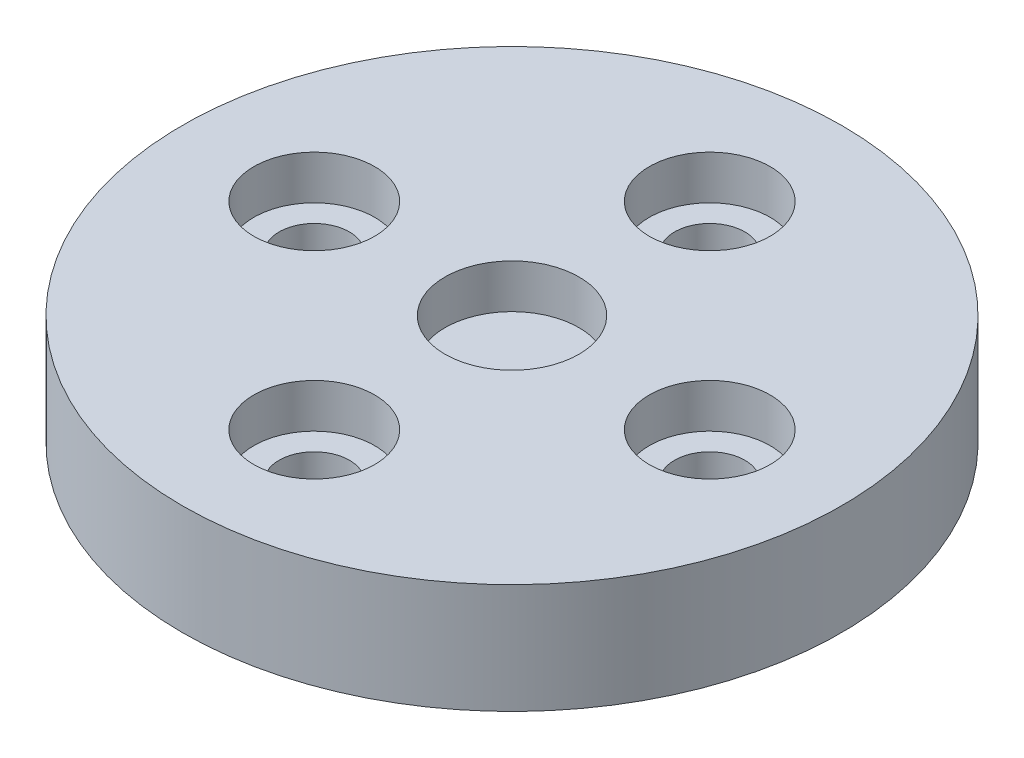
from build123d import *

# Parameters (mm, degrees)
SKETCH1_R           = 15
BOSS_EXTRUDE1_DEPTH = 5
SKETCH2_R           = 3
CUT_EXTRUDE1_DEPTH  = 2
SKETCH3_R           = 1.6
CUT_EXTRUDE2_DEPTH  = 5
SKETCH4_R           = 2.75
SKETCH4_R_2         = 3.05
CUT_EXTRUDE3_DEPTH  = 2


with BuildPart() as part:
    # Sketch1 → Boss-Extrude1 (new body)
    with BuildSketch(Plane(origin=(0, 0, 0), x_dir=(1, 0, 0), z_dir=(0, 1, 0))):
        with Locations(Location((0, 0, 0), (0, 0, 270))):
            Circle(SKETCH1_R)
    extrude(amount=BOSS_EXTRUDE1_DEPTH)

    # Sketch2 → Cut-Extrude1 (cut)
    with BuildSketch(Plane.XZ):
        with Locations(Location((0, 0, 0), (0, 0, 270))):
            Circle(SKETCH2_R)
    extrude(amount=-CUT_EXTRUDE1_DEPTH, mode=Mode.SUBTRACT)

    # Sketch3 → Cut-Extrude2 (cut)
    with BuildSketch(Plane(origin=(0, 5, 0), x_dir=(1, 0, 0), z_dir=(0, 1, 0))):
        with Locations(Location((0, 9, 0), (0, 0, 270))):
            Circle(SKETCH3_R)
        with Locations(Location((0, -9, 0), (0, 0, 270))):
            Circle(SKETCH3_R)
        with Locations(Location((9, 0, 0), (0, 0, 270))):
            Circle(SKETCH3_R)
        with Locations(Location((-9, 0, 0), (0, 0, 270))):
            Circle(SKETCH3_R)
    extrude(amount=-CUT_EXTRUDE2_DEPTH, mode=Mode.SUBTRACT)

    # Sketch4 → Cut-Extrude3 (cut)
    with BuildSketch(Plane(origin=(0, 5, 0), x_dir=(1, 0, 0), z_dir=(0, 1, 0))):
        with Locations(Location((0, 9, 0), (0, 0, 270))):
            Circle(SKETCH4_R)
        with Locations(Location((-9, 0, 0), (0, 0, 270))):
            Circle(SKETCH4_R)
        with Locations(Location((9, 0, 0), (0, 0, 270))):
            Circle(SKETCH4_R)
        with Locations(Location((0, -9, 0), (0, 0, 270))):
            Circle(SKETCH4_R)
        with Locations(Location((0, 0, 0), (0, 0, 270))):
            Circle(SKETCH4_R_2)
    extrude(amount=-CUT_EXTRUDE3_DEPTH, mode=Mode.SUBTRACT)


solid = part.part
